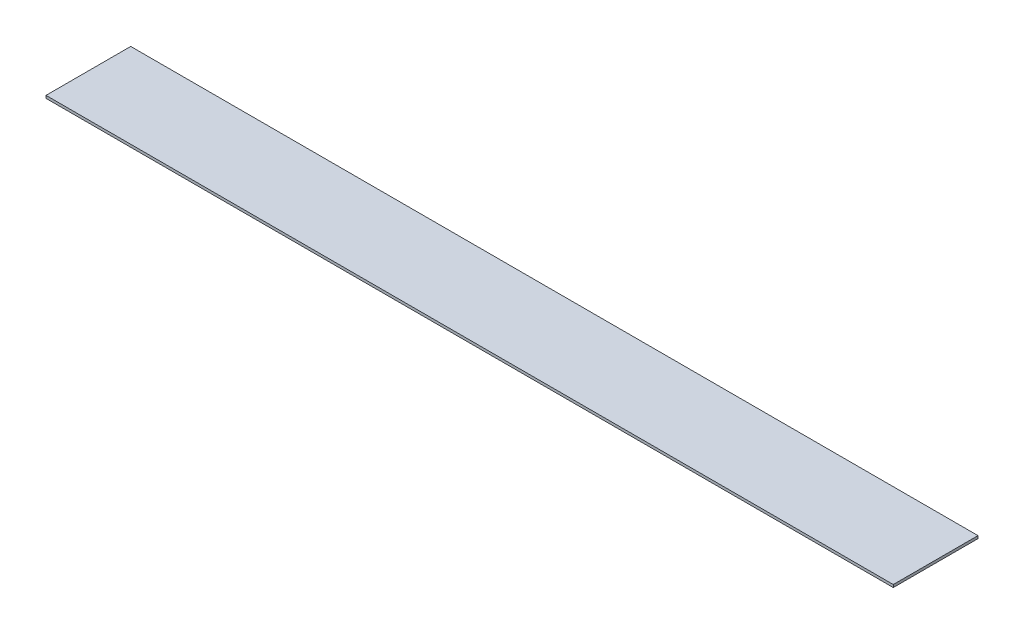
from build123d import *

# Parameters (mm, degrees)
SKETCH1_W           = 508
SKETCH1_H           = 50.8
BOSS_EXTRUDE1_DEPTH = 1.5875


with BuildPart() as part:
    # Sketch1 → Boss-Extrude1 (new body)
    with BuildSketch(Plane.XZ):
        with Locations((254, 25.4)):
            Rectangle(SKETCH1_W, SKETCH1_H)
    extrude(amount=BOSS_EXTRUDE1_DEPTH)


solid = part.part
